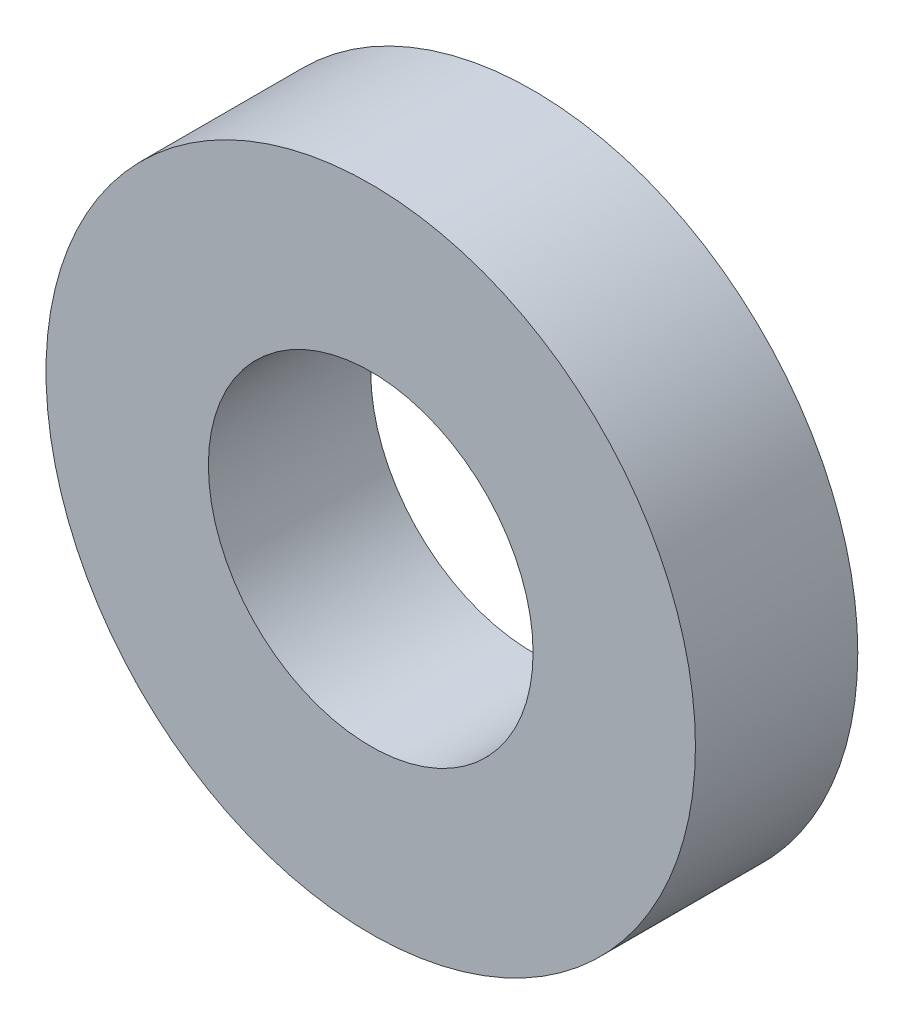
from build123d import *

# Parameters (mm, degrees)
SKETCH1_R           = 3
SKETCH1_R_2         = 1.5
BOSS_EXTRUDE1_DEPTH = 1.5


with BuildPart() as part:
    # Sketch1 → Boss-Extrude1 (new body)
    with BuildSketch(Plane.XY):
        Circle(SKETCH1_R)
        Circle(SKETCH1_R_2, mode=Mode.SUBTRACT)
    extrude(amount=BOSS_EXTRUDE1_DEPTH)


solid = part.part
